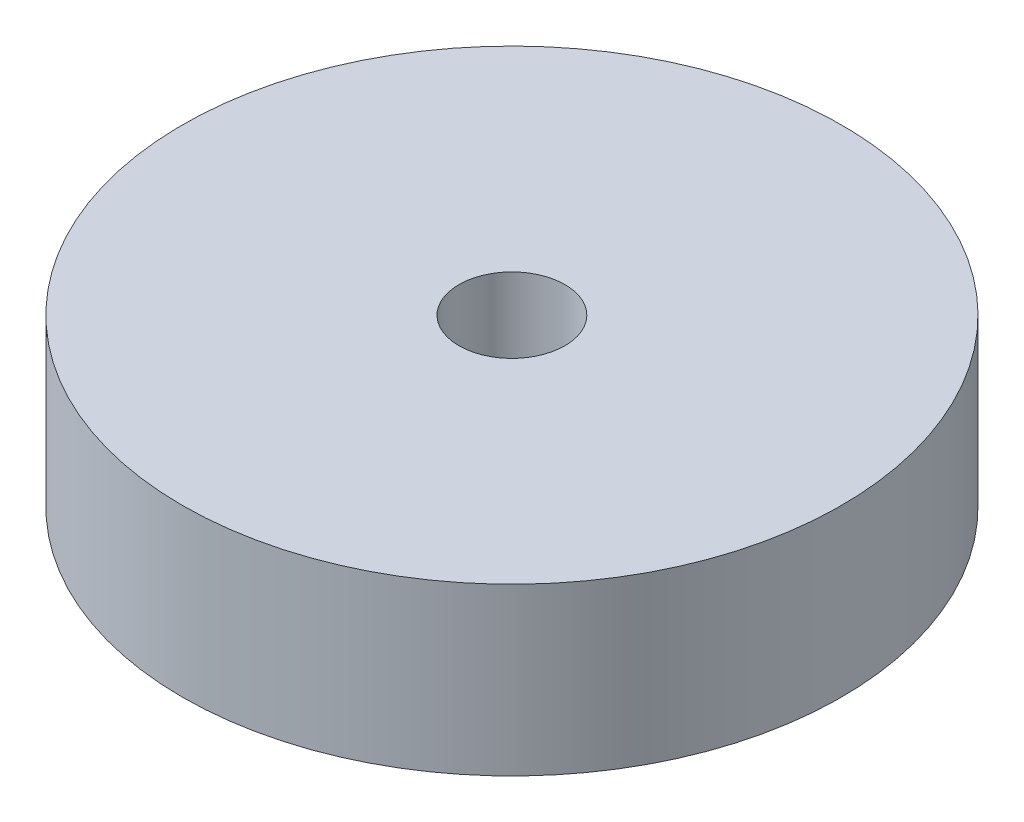
from build123d import *

# Parameters (mm, degrees)
SKETCH1_R               = 15.875
BOSS_EXTRUDE1_DEPTH     = 8
F_1_4_20_TAPPED_HOLE1_D = 5.1054


with BuildPart() as part:
    # Sketch1 → Boss-Extrude1 (new body)
    with BuildSketch(Plane(origin=(0, 0, 0), x_dir=(1, 0, 0), z_dir=(0, 1, 0))):
        with Locations(Location((0, 0, 0), (0, 0, 270))):
            Circle(SKETCH1_R)
    extrude(amount=BOSS_EXTRUDE1_DEPTH)

    # 1/4-20 Tapped Hole1 (through all)
    with Locations(Plane(origin=(0, 8, 0), x_dir=(1, 0, 0), z_dir=(0, 1, 0))):
        with Locations((0, 0)):
            Hole(F_1_4_20_TAPPED_HOLE1_D / 2)


solid = part.part
